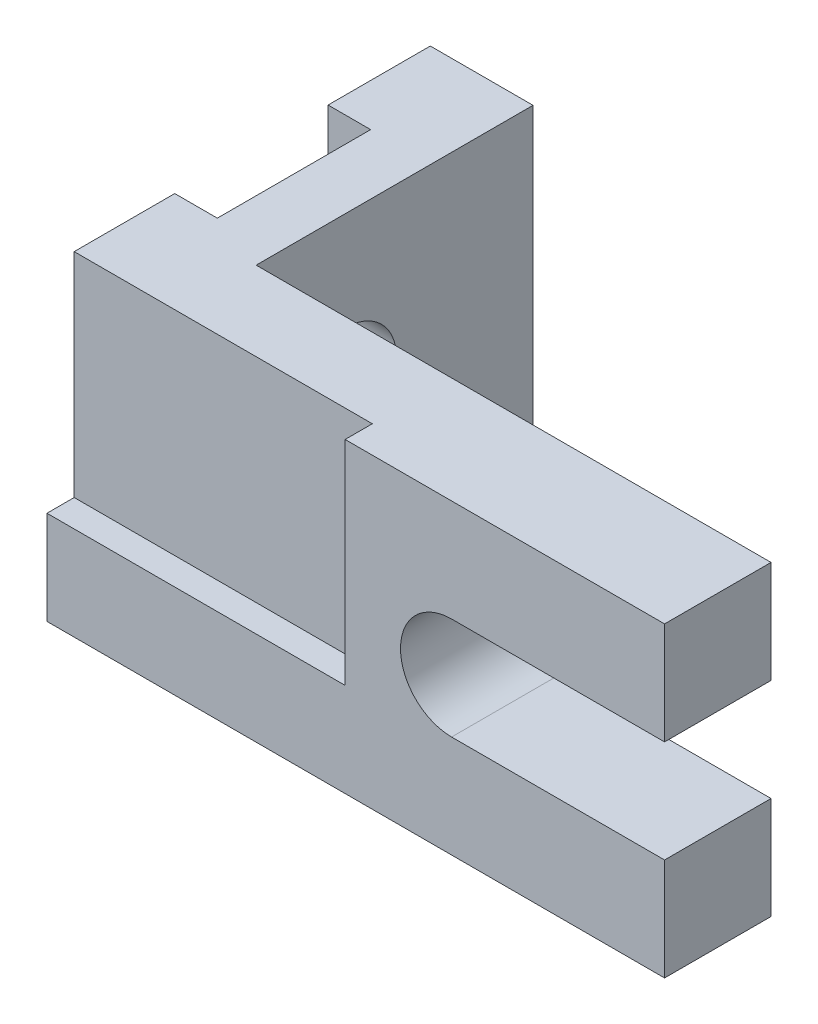
from build123d import *

# Parameters (mm, degrees)
SKETCH1_W               = 145
SKETCH1_H               = 72
BOSS_EXTRUDE1_DEPTH     = 25
BOSS_EXTRUDE13_DEPTH    = 72
SKETCH16_R              = 12
CUT_EXTRUDE1_DEPTH      = 10
CUT_EXTRUDE2_DEPTH      = 175.453432182
CUT_EXTRUDE2_DEPTH_BACK = 50
SKETCH17_W              = 70
SKETCH17_H              = 6.390151493
SKETCH18_R              = 12
CUT_EXTRUDE3_DEPTH      = 24
CUT_EXTRUDE4_DEPTH      = 175.453432182
CUT_EXTRUDE4_DEPTH_BACK = 25


with BuildPart() as part:
    # Sketch1 → Boss-Extrude1 (new body)
    with BuildSketch(Plane.XY):
        with Locations((72.5, 36)):
            Rectangle(SKETCH1_W, SKETCH1_H)
    extrude(amount=BOSS_EXTRUDE1_DEPTH)

    # Sketch5 → Boss-Extrude13 (add)
    with BuildSketch(Plane(origin=(0, 72, 0), x_dir=(1, 0, 0), z_dir=(0, 1, 0))):
        Polygon((0, 65), (0, 0), (1.798699266, 0), (24.115506302, 0), (24.115506302, 65), align=None)
    extrude(amount=-BOSS_EXTRUDE13_DEPTH)

    # Sketch16 → Cut-Extrude1 (cut)
    # profile 1 of 6: a face of its own
    with BuildSketch(Plane.ZY):
        with BuildLine():
            ThreePointArc((-5, 61.980762114), (-23.767010787, 65.762554153), (-41, 57.424285286))
            Line((-41, 57.424285286), (-41, 14.575714714))
            ThreePointArc((-41, 14.575714714), (-23.767010787, 6.237445847), (-5, 10.019237886))
            Line((-5, 10.019237886), (-5, 61.980762114))
        make_face()
        with Locations((-20, 36)):
            Circle(SKETCH16_R, mode=Mode.SUBTRACT)
    # profile 2 of 6: a face of its own
    with BuildSketch(Plane.ZY):
        with Locations((-20, 36)):
            Circle(SKETCH16_R)
    # profile 3 of 6: a face of its own
    with BuildSketch(Plane.ZY):
        with BuildLine():
            ThreePointArc((10, 36), (5.980762114, 51), (-5, 61.980762114))
            Line((-5, 61.980762114), (-5, 10.019237886))
            ThreePointArc((-5, 10.019237886), (5.980762114, 21), (10, 36))
        make_face()
    # profile 4 of 6: a face of its own
    with BuildSketch(Plane.ZY):
        with BuildLine():
            Line((-41, 14.575714714), (-41, 57.424285286))
            ThreePointArc((-41, 57.424285286), (-50, 36), (-41, 14.575714714))
        make_face()
    # profile 5 of 6: a face of its own
    with BuildSketch(Plane.ZY):
        with BuildLine():
            Line((-5, 72), (-41, 72))
            Line((-41, 72), (-41, 57.424285286))
            ThreePointArc((-41, 57.424285286), (-23.767010787, 65.762554153), (-5, 61.980762114))
            Line((-5, 61.980762114), (-5, 72))
        make_face()
    # profile 6 of 6: a face of its own
    with BuildSketch(Plane.ZY):
        with BuildLine():
            ThreePointArc((-5, 10.019237886), (-23.767010787, 6.237445847), (-41, 14.575714714))
            Line((-41, 14.575714714), (-41, 0))
            Line((-41, 0), (-5, 0))
            Line((-5, 0), (-5, 10.019237886))
        make_face()
    extrude(amount=-CUT_EXTRUDE1_DEPTH, mode=Mode.SUBTRACT)

    # Sketch17 → Cut-Extrude2 (cut, two sides: drawn at the far end of the back side and taken through both)
    with BuildSketch(Plane(origin=(0, 72, 0), x_dir=(1, 0, 0), z_dir=(0, 1, 0)).offset(-CUT_EXTRUDE2_DEPTH_BACK)):
        with Locations((35, -21.804924254)):
            Rectangle(SKETCH17_W, SKETCH17_H)
    extrude(amount=CUT_EXTRUDE2_DEPTH + CUT_EXTRUDE2_DEPTH_BACK, mode=Mode.SUBTRACT)

    # Sketch18 → Cut-Extrude3 (cut)
    with BuildSketch(Plane.ZY.offset(-10)):
        with Locations((-20.942172697, 36.785143914)):
            Circle(SKETCH18_R)
    extrude(amount=-CUT_EXTRUDE3_DEPTH, mode=Mode.SUBTRACT)

    # Sketch19 → Cut-Extrude4 (cut, two sides: drawn at the far end of the back side and taken through both)
    with BuildSketch(Plane(origin=(0, 0, 0), x_dir=(-1, 0, 0), z_dir=(0, 0, -1)).offset(-CUT_EXTRUDE4_DEPTH_BACK)):
        with BuildLine():
            Line((-145, 24), (-95, 24))
            ThreePointArc((-95, 24), (-83, 36), (-95, 48))
            Line((-95, 48), (-145, 48))
            Line((-145, 48), (-145, 24))
        make_face()
    extrude(amount=CUT_EXTRUDE4_DEPTH + CUT_EXTRUDE4_DEPTH_BACK, mode=Mode.SUBTRACT)


solid = part.part
